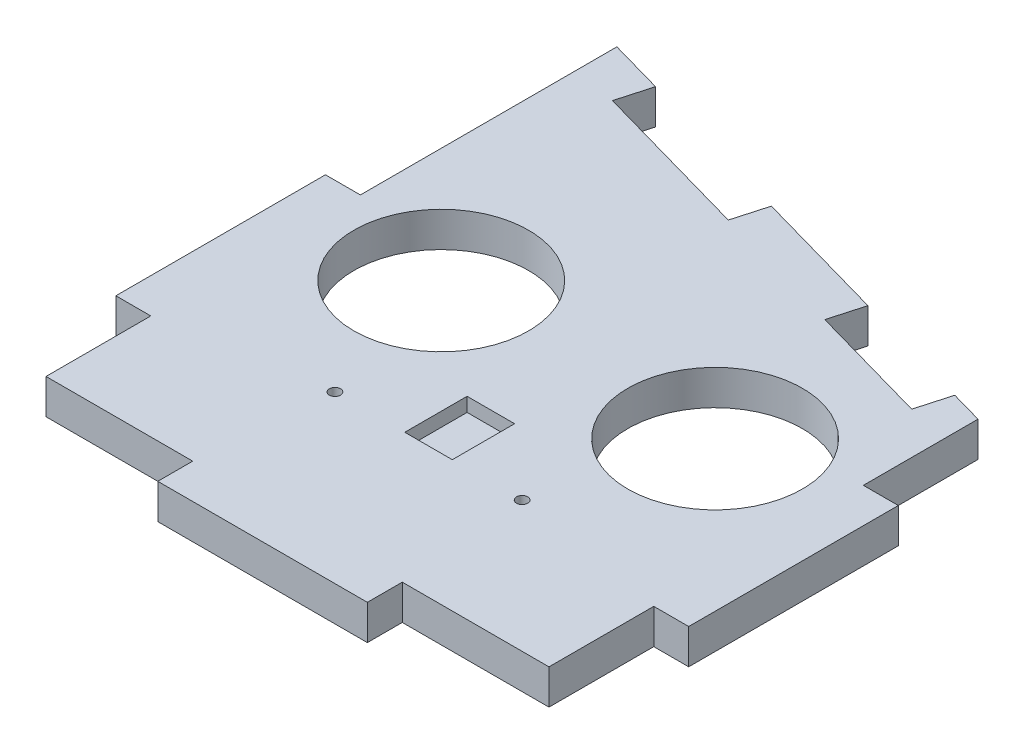
from build123d import *

# Parameters (mm, degrees)
SKETCH1_R           = 7.9375
BOSS_EXTRUDE1_DEPTH = 3.175
SKETCH2_W           = 4.318
SKETCH2_H           = 5.6642
CUT_EXTRUDE1_DEPTH  = 1.27
SKETCH3_R           = 0.508
CUT_EXTRUDE2_DEPTH  = 74.581244154


with BuildPart() as part:
    # Sketch1 → Boss-Extrude1 (new body)
    with BuildSketch(Plane(origin=(0, 0, 0), x_dir=(1, 0, 0), z_dir=(0, 1, 0))):
        Polygon((16.51, 0), (3.175, 0), (3.175, 9.525), (0, 9.525), (0, 28.575), (3.175, 28.575), (3.175, 51.892523221), (8.067183099, 50.512514038), (7.205202957, 47.456762864), (21.872808591, 43.319258185), (22.734788732, 46.375009359), (34.957793427, 42.927088793), (34.095813286, 39.871337619), (45.096517511, 36.768209109), (45.958497653, 39.823960283), (48.895, 38.995618391), (48.895, 28.575), (52.07, 28.575), (52.07, 9.525), (48.895, 9.525), (48.895, 0), (35.56, 0), (35.56, -3.175), (16.51, -3.175), align=None)
        with Locations(Location((13.589, 25.512426191, 0), (0, 0, 270))):
            Circle(SKETCH1_R, mode=Mode.SUBTRACT)
        with Locations(Location((38.481, 25.512426191, 0), (0, 0, 270))):
            Circle(SKETCH1_R, mode=Mode.SUBTRACT)
    extrude(amount=BOSS_EXTRUDE1_DEPTH)

    # Sketch2 → Cut-Extrude1 (cut)
    with BuildSketch(Plane(origin=(0, 3.175, 0), x_dir=(1, 0, 0), z_dir=(0, 1, 0))):
        with Locations((26.035, 14.742826191)):
            Rectangle(SKETCH2_W, SKETCH2_H)
    extrude(amount=-CUT_EXTRUDE1_DEPTH, mode=Mode.SUBTRACT)

    # Sketch3 → Cut-Extrude2 (cut, through all)
    with BuildSketch(Plane(origin=(0, 3.175, 0), x_dir=(1, 0, 0), z_dir=(0, 1, 0))):
        with Locations(Location((17.526, 11.910726191, 0), (0, 0, 270))):
            Circle(SKETCH3_R)
        with Locations(Location((34.544, 11.910726191, 0), (0, 0, 270))):
            Circle(SKETCH3_R)
    extrude(amount=-CUT_EXTRUDE2_DEPTH, mode=Mode.SUBTRACT)


solid = part.part
